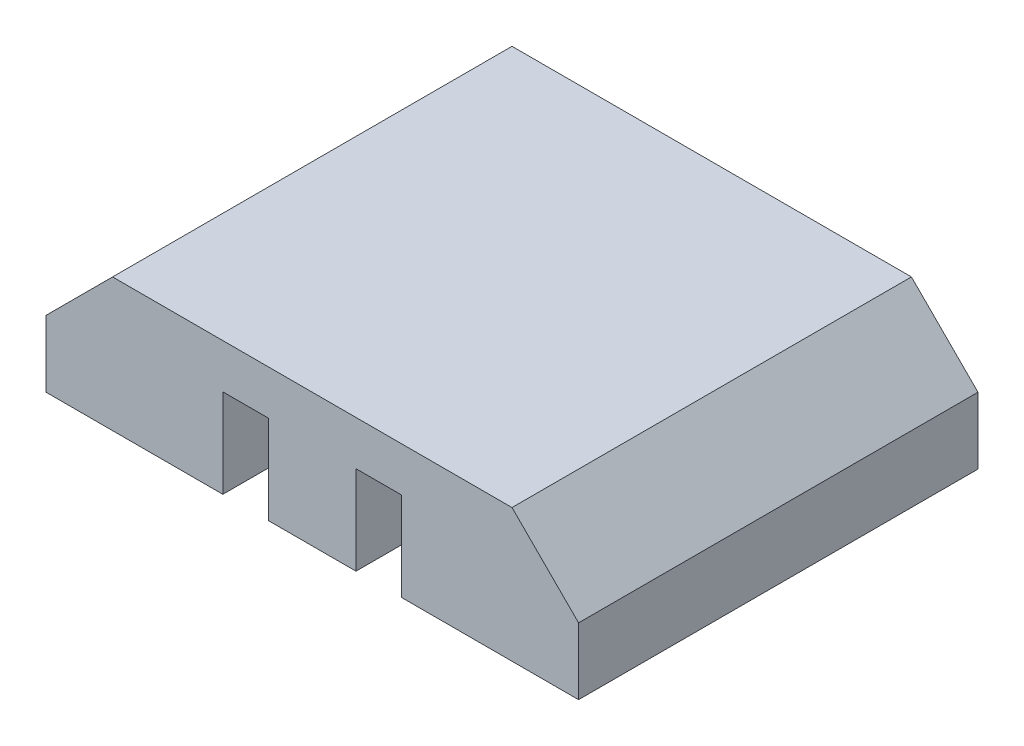
from build123d import *

# Parameters (mm, degrees)
SKETCH2_W             = 39.85
SKETCH2_H             = 90
BOSS_EXTRUDE1_DEPTH   = 20
BOSS_EXTRUDE1_2_DEPTH = 20
BOSS_EXTRUDE1_3_DEPTH = 20
BOSS_EXTRUDE1_4_DEPTH = 20
SKETCH3_W             = 120
SKETCH3_H             = 90
BOSS_EXTRUDE2_DEPTH   = 10
CUT_EXTRUDE2_DEPTH    = 114


with BuildPart() as part:
    # Sketch2 → Boss-Extrude1 (new body)
    with BuildSketch(Plane(origin=(0, 0, 0), x_dir=(1, 0, 0), z_dir=(0, 1, 0))):
        with Locations((-0.075, 90)):
            Rectangle(SKETCH2_W, SKETCH2_H)
    extrude(amount=BOSS_EXTRUDE1_DEPTH)



with BuildPart() as body_2:
    # Sketch2 → Boss-Extrude1 2 (new body)
    with BuildSketch(Plane(origin=(0, 0, 0), x_dir=(1, 0, 0), z_dir=(0, 1, 0))):
        Polygon((49.85, 95.15), (49.85, 134.85), (49.85, 135), (30.15, 135), (30.15, 134.85), (30.15, 95.15), align=None)
    extrude(amount=BOSS_EXTRUDE1_2_DEPTH)


with BuildPart() as body_3:
    # Sketch2 → Boss-Extrude1 3 (new body)
    with BuildSketch(Plane(origin=(0, 0, 0), x_dir=(1, 0, 0), z_dir=(0, 1, 0))):
        Polygon((49.85, 45.15), (49.85, 45), (30.15, 45), (30.15, 45.15), (30.15, 84.85), (49.85, 84.85), align=None)
    extrude(amount=BOSS_EXTRUDE1_3_DEPTH)


with BuildPart() as body_4:
    # Sketch2 → Boss-Extrude1 4 (new body)
    with BuildSketch(Plane(origin=(0, 0, 0), x_dir=(1, 0, 0), z_dir=(0, 1, 0))):
        with Locations((80.075, 90)):
            Rectangle(SKETCH2_W, SKETCH2_H)
    extrude(amount=BOSS_EXTRUDE1_4_DEPTH)


with BuildPart() as part_1:
    add(part.part)

    add(body_2.part)  # Boss-Extrude2 merges body 2

    add(body_3.part)  # Boss-Extrude2 merges body 3

    add(body_4.part)  # Boss-Extrude2 merges body 4
    # Sketch3 → Boss-Extrude2 (add)
    with BuildSketch(Plane(origin=(0, 20, 0), x_dir=(1, 0, 0), z_dir=(0, 1, 0))):
        with Locations((40, 90)):
            Rectangle(SKETCH3_W, SKETCH3_H)
    extrude(amount=BOSS_EXTRUDE2_DEPTH)

    # Sketch5 → Cut-Extrude2 (cut)
    with BuildSketch(Plane.XY.offset(-45)):
        Polygon((-20, 30), (-20, 15), (-5, 30), align=None)
        Polygon((100, 30), (85, 30), (100, 15), align=None)
    extrude(amount=-CUT_EXTRUDE2_DEPTH, mode=Mode.SUBTRACT)


solid = part_1.part
